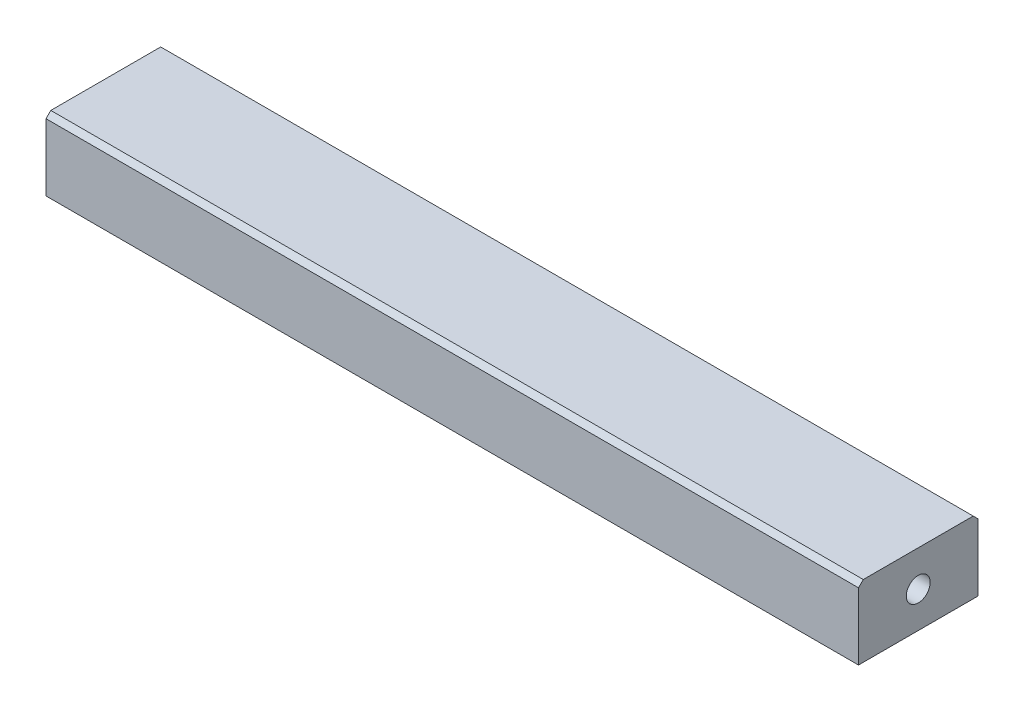
from build123d import *

# Parameters (mm, degrees)
SKETCH_1_W          = 85
SKETCH_1_H          = 7.5
EXTRUDE_1_DEPTH     = 12.5
SKETCH_2_R          = 1.25
CUT_EXTRUDE_1_DEPTH = 86.996002814
CHAMFER_1_SIZE      = 0.5


with BuildPart() as part:
    # 草图1 → 凸台-拉伸1 (new body)
    with BuildSketch(Plane.XY):
        Rectangle(SKETCH_1_W, SKETCH_1_H)
    extrude(amount=EXTRUDE_1_DEPTH)

    # 草图2 → 切除-拉伸1 (cut, through all)
    with BuildSketch(Plane(origin=(42.5, 0, 0), x_dir=(0, 0, -1), z_dir=(1, 0, 0))):
        with Locations((-6.25, 0)):
            Circle(SKETCH_2_R)
    extrude(amount=-CUT_EXTRUDE_1_DEPTH, mode=Mode.SUBTRACT)

    # 倒角1
    chamfer_1_edges = [part.edges().sort_by_distance(p)[0] for p in [
        (0, 3.75, 12.5),
        (0, 3.75, 0),
    ]]
    chamfer(chamfer_1_edges, length=CHAMFER_1_SIZE)


solid = part.part
